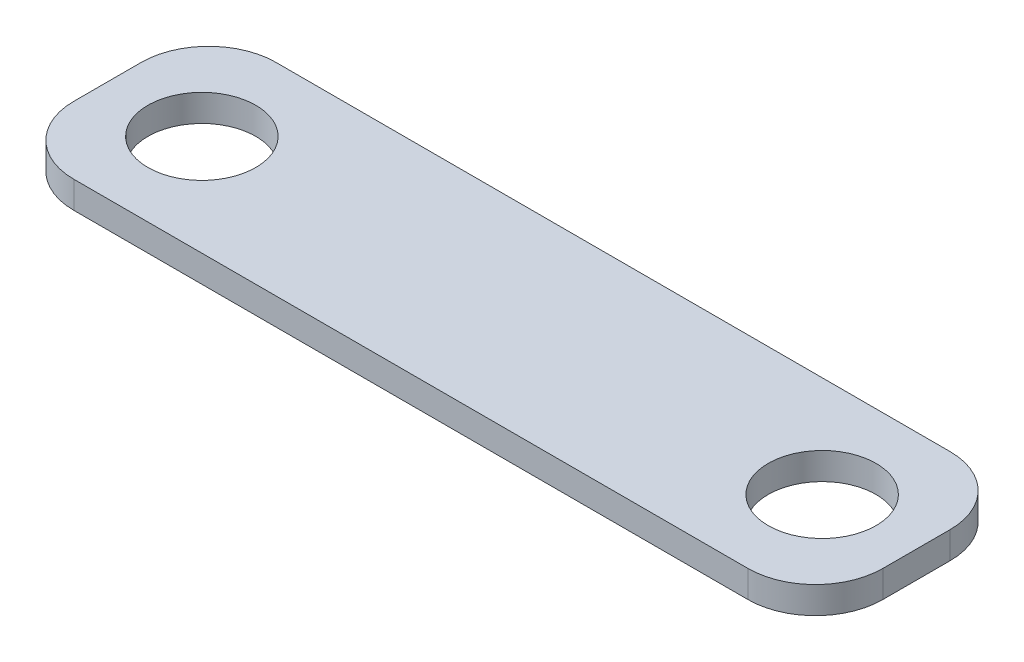
from build123d import *

# Parameters (mm, degrees)
SKETCH1_W           = 60
SKETCH1_H           = 15
BOSS_EXTRUDE1_DEPTH = 2
SKETCH2_R           = 4
CUT_EXTRUDE1_DEPTH  = 2
FILLET2_R           = 5


with BuildPart() as part:
    # Sketch1 → Boss-Extrude1 (new body)
    with BuildSketch(Plane(origin=(0, 0, 0), x_dir=(1, 0, 0), z_dir=(0, 1, 0))):
        with Locations((30, 9.203056769)):
            Rectangle(SKETCH1_W, SKETCH1_H)
    extrude(amount=BOSS_EXTRUDE1_DEPTH)

    # Sketch2 → Cut-Extrude1 (cut)
    with BuildSketch(Plane(origin=(0, 2, 0), x_dir=(1, 0, 0), z_dir=(0, 1, 0))):
        with Locations(Location((7, 9.203056769, 0), (0, 0, 270))):
            Circle(SKETCH2_R)
        with Locations(Location((53, 9.203056769, 0), (0, 0, 270))):
            Circle(SKETCH2_R)
    extrude(amount=-CUT_EXTRUDE1_DEPTH, mode=Mode.SUBTRACT)

    # Fillet2
    fillet2_edges = [part.edges().sort_by_distance(p)[0] for p in [
        (0, 1, -16.703056769),
        (60, 1, -16.703056769),
        (60, 1, -1.703056769),
        (0, 1, -1.703056769),
    ]]
    fillet(fillet2_edges, radius=FILLET2_R)


solid = part.part
